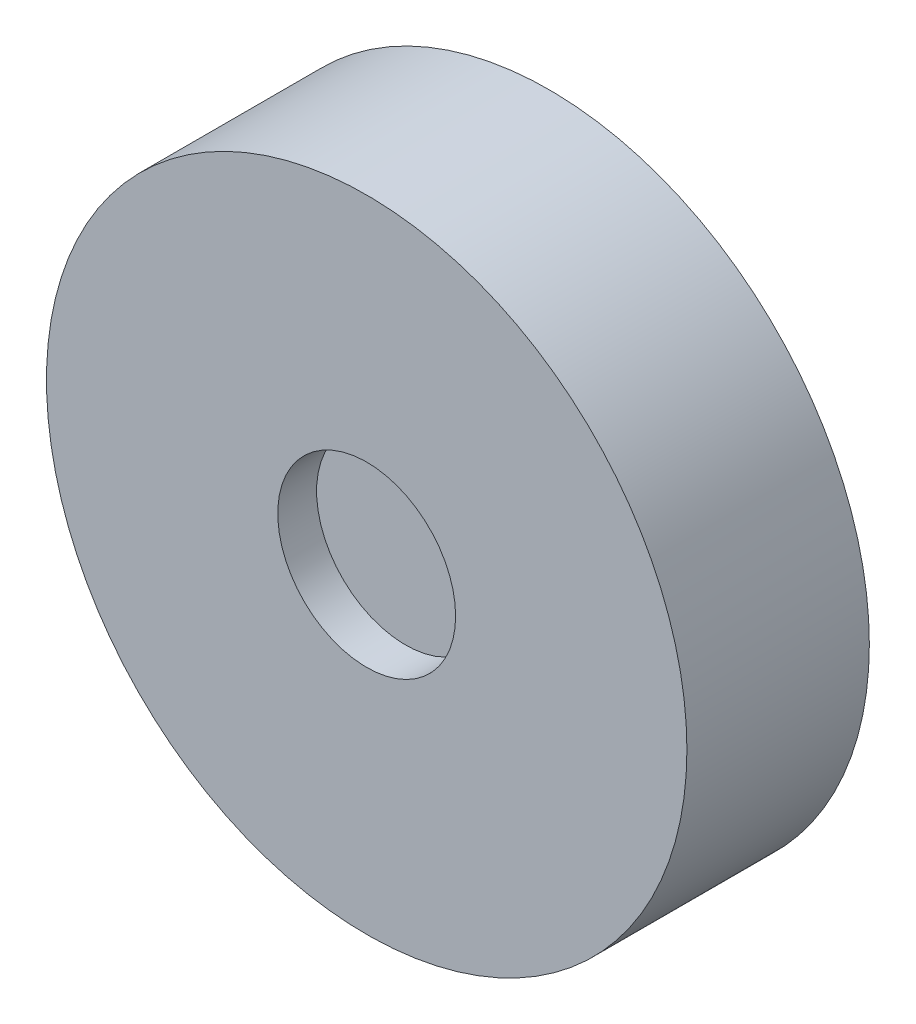
from build123d import *

# Parameters (mm, degrees)
SKETCH1_R                     = 165
BOSS_EXTRUDE1_DEPTH           = 94
CUT_EXTRUDE7_DEPTH            = 44
CUT_EXTRUDE7_DRAFT            = 6
CUT_EXTRUDE7_PROFILE_2_DEPTH  = 44
CUT_EXTRUDE7_PROFILE_2_DRAFT  = 6
CUT_EXTRUDE7_PROFILE_3_DEPTH  = 44
CUT_EXTRUDE7_PROFILE_3_DRAFT  = 6
CUT_EXTRUDE7_PROFILE_4_DEPTH  = 44
CUT_EXTRUDE7_PROFILE_4_DRAFT  = 6
CUT_EXTRUDE7_PROFILE_5_DEPTH  = 44
CUT_EXTRUDE7_PROFILE_5_DRAFT  = 6
CUT_EXTRUDE7_PROFILE_6_DEPTH  = 44
CUT_EXTRUDE7_PROFILE_6_DRAFT  = 6
CUT_EXTRUDE7_PROFILE_7_DEPTH  = 44
CUT_EXTRUDE7_PROFILE_7_DRAFT  = 6
CUT_EXTRUDE7_PROFILE_8_DEPTH  = 44
CUT_EXTRUDE7_PROFILE_8_DRAFT  = 6
CUT_EXTRUDE7_PROFILE_9_DEPTH  = 44
CUT_EXTRUDE7_PROFILE_9_DRAFT  = 6
CUT_EXTRUDE7_PROFILE_10_DEPTH = 44
CUT_EXTRUDE7_PROFILE_10_DRAFT = 6
CUT_EXTRUDE7_PROFILE_11_DEPTH = 44
CUT_EXTRUDE7_PROFILE_11_DRAFT = 6
CUT_EXTRUDE7_PROFILE_12_DEPTH = 44
CUT_EXTRUDE7_PROFILE_12_DRAFT = 6
SKETCH3_R                     = 124.372017203
SKETCH3_R_2                   = 113.555284958
CUT_EXTRUDE8_DEPTH            = 3
SKETCH4_OUTSIDE_W             = 427.212
SKETCH4_OUTSIDE_H             = 427.212
SKETCH4_OUTSIDE_R             = 165
SKETCH4_OUTSIDE_R_2           = 45.82477688
CUT_EXTRUDE9_DEPTH            = 20


with BuildPart() as part:
    # Sketch1 → Boss-Extrude1 (new body)
    with BuildSketch(Plane.XY):
        with Locations((-394.292920308, -79.904057714)):
            Circle(SKETCH1_R)
    extrude(amount=BOSS_EXTRUDE1_DEPTH)


with BuildPart() as cut_extrude7_tool:
    # Sketch2 → Cut-Extrude7 (with draft: the straight prism first)
    with BuildSketch(Plane.XY):
        with BuildLine():
            ThreePointArc((-467.639479029, -22.199836842), (-476.994852518, -36.462446087), (-483.682256538, -52.153961727))
            ThreePointArc((-483.682256538, -52.153961727), (-458.559252612, -62.946672421), (-431.984974644, -69.385281038))
            ThreePointArc((-431.984974644, -69.385281038), (-425.372423175, -66.397451896), (-425.442963934, -59.14155885))
            ThreePointArc((-425.442963934, -59.14155885), (-445.877571681, -39.912646859), (-467.639479029, -22.199836842))
        make_face()
    extrude(amount=CUT_EXTRUDE7_DEPTH)
    # Cut-Extrude7: the draft: its side faces are tilted about the plane it starts from
    cut_extrude7_sides = [cut_extrude7_tool.faces().sort_by_distance(p)[0] for p in [
        (-476.994852518, -36.462446087, 22),
        (-458.559252612, -62.946672421, 22),
        (-425.372423175, -66.397451896, 22),
        (-445.877571681, -39.912646859, 22),
    ]]
    draft(cut_extrude7_sides, Plane.XY, CUT_EXTRUDE7_DRAFT)


with BuildPart() as part_1:
    add(part.part)

    # Cut-Extrude7: cut by cut_extrude7_tool
    add(cut_extrude7_tool.part, mode=Mode.SUBTRACT)


with BuildPart() as cut_extrude7_profile_2_tool:
    # Sketch2 → Cut-Extrude7 profile 2 (with draft: the straight prism first)
    with BuildSketch(Plane.XY):
        with BuildLine():
            ThreePointArc((-487.36401918, -67.885154466), (-488.334705662, -84.914623141), (-486.280409608, -101.847576319))
            ThreePointArc((-486.280409608, -101.847576319), (-459.126894641, -98.632835993), (-432.893590526, -90.921695636))
            ThreePointArc((-432.893590526, -90.921695636), (-428.660867541, -85.027883963), (-432.349904153, -78.779366636))
            ThreePointArc((-432.349904153, -78.779366636), (-459.661249574, -72.343944239), (-487.36401918, -67.885154466))
        make_face()
    extrude(amount=CUT_EXTRUDE7_PROFILE_2_DEPTH)
    # Cut-Extrude7 profile 2: the draft: its side faces are tilted about the plane it starts from
    cut_extrude7_profile_2_sides = [cut_extrude7_profile_2_tool.faces().sort_by_distance(p)[0] for p in [
        (-488.334705662, -84.914623141, 22),
        (-459.126894641, -98.632835993, 22),
        (-428.660867541, -85.027883963, 22),
        (-459.661249574, -72.343944239, 22),
    ]]
    draft(cut_extrude7_profile_2_sides, Plane.XY, CUT_EXTRUDE7_PROFILE_2_DRAFT)


with BuildPart() as part_2:
    add(part_1.part)

    # Cut-Extrude7 profile 2: cut by cut_extrude7_profile_2_tool
    add(cut_extrude7_profile_2_tool.part, mode=Mode.SUBTRACT)


with BuildPart() as cut_extrude7_profile_3_tool:
    # Sketch2 → Cut-Extrude7 profile 3 (with draft: the straight prism first)
    with BuildSketch(Plane.XY):
        with BuildLine():
            ThreePointArc((-427.714867368, 7.502538725), (-442.948163094, -0.171556461), (-456.58538268, -10.41710562))
            ThreePointArc((-456.58538268, -10.41710562), (-440.224578408, -32.325369219), (-420.429882909, -51.18850683))
            ThreePointArc((-420.429882909, -51.18850683), (-413.209330783, -51.907246626), (-409.642474348, -45.588188541))
            ThreePointArc((-409.642474348, -45.588188541), (-417.724907778, -18.718158396), (-427.714867368, 7.502538725))
        make_face()
    extrude(amount=CUT_EXTRUDE7_PROFILE_3_DEPTH)
    # Cut-Extrude7 profile 3: the draft: its side faces are tilted about the plane it starts from
    cut_extrude7_profile_3_sides = [cut_extrude7_profile_3_tool.faces().sort_by_distance(p)[0] for p in [
        (-442.948163094, -0.171556461, 22),
        (-440.224578408, -32.325369219, 22),
        (-413.209330783, -51.907246626, 22),
        (-417.724907778, -18.718158396, 22),
    ]]
    draft(cut_extrude7_profile_3_sides, Plane.XY, CUT_EXTRUDE7_PROFILE_3_DRAFT)


with BuildPart() as part_3:
    add(part_2.part)

    # Cut-Extrude7 profile 3: cut by cut_extrude7_profile_3_tool
    add(cut_extrude7_profile_3_tool.part, mode=Mode.SUBTRACT)


with BuildPart() as cut_extrude7_profile_4_tool:
    # Sketch2 → Cut-Extrude7 profile 4 (with draft: the straight prism first)
    with BuildSketch(Plane.XY):
        with BuildLine():
            ThreePointArc((-378.28795165, 13.263244687), (-395.317420325, 14.233931169), (-412.250373503, 12.179635115))
            ThreePointArc((-412.250373503, 12.179635115), (-409.035633176, -14.973879852), (-401.32449282, -41.207183967))
            ThreePointArc((-401.32449282, -41.207183967), (-395.430681147, -45.439906952), (-389.18216382, -41.75087034))
            ThreePointArc((-389.18216382, -41.75087034), (-382.746741422, -14.439524919), (-378.28795165, 13.263244687))
        make_face()
    extrude(amount=CUT_EXTRUDE7_PROFILE_4_DEPTH)
    # Cut-Extrude7 profile 4: the draft: its side faces are tilted about the plane it starts from
    cut_extrude7_profile_4_sides = [cut_extrude7_profile_4_tool.faces().sort_by_distance(p)[0] for p in [
        (-395.317420325, 14.233931169, 22),
        (-409.035633176, -14.973879852, 22),
        (-395.430681147, -45.439906952, 22),
        (-382.746741422, -14.439524919, 22),
    ]]
    draft(cut_extrude7_profile_4_sides, Plane.XY, CUT_EXTRUDE7_PROFILE_4_DRAFT)


with BuildPart() as part_4:
    add(part_3.part)

    # Cut-Extrude7 profile 4: cut by cut_extrude7_profile_4_tool
    add(cut_extrude7_profile_4_tool.part, mode=Mode.SUBTRACT)


with BuildPart() as cut_extrude7_profile_5_tool:
    # Sketch2 → Cut-Extrude7 profile 5 (with draft: the straight prism first)
    with BuildSketch(Plane.XY):
        with BuildLine():
            ThreePointArc((-332.602634026, -6.461295464), (-346.865243271, 2.894078025), (-362.556758911, 9.581482045))
            ThreePointArc((-362.556758911, 9.581482045), (-373.349469605, -15.541521881), (-379.788078221, -42.115799849))
            ThreePointArc((-379.788078221, -42.115799849), (-376.80024908, -48.728351317), (-369.544356033, -48.657810559))
            ThreePointArc((-369.544356033, -48.657810559), (-350.315444042, -28.223202812), (-332.602634026, -6.461295464))
        make_face()
    extrude(amount=CUT_EXTRUDE7_PROFILE_5_DEPTH)
    # Cut-Extrude7 profile 5: the draft: its side faces are tilted about the plane it starts from
    cut_extrude7_profile_5_sides = [cut_extrude7_profile_5_tool.faces().sort_by_distance(p)[0] for p in [
        (-350.315444042, -28.223202812, 22),
        (-346.865243271, 2.894078025, 22),
        (-373.349469605, -15.541521881, 22),
        (-376.80024908, -48.728351317, 22),
    ]]
    draft(cut_extrude7_profile_5_sides, Plane.XY, CUT_EXTRUDE7_PROFILE_5_DRAFT)


with BuildPart() as part_5:
    add(part_4.part)

    # Cut-Extrude7 profile 5: cut by cut_extrude7_profile_5_tool
    add(cut_extrude7_profile_5_tool.part, mode=Mode.SUBTRACT)


with BuildPart() as cut_extrude7_profile_6_tool:
    # Sketch2 → Cut-Extrude7 profile 6 (with draft: the straight prism first)
    with BuildSketch(Plane.XY):
        with BuildLine():
            ThreePointArc((-302.900258459, -46.385907125), (-310.574353645, -31.152611399), (-320.819902803, -17.515391812))
            ThreePointArc((-320.819902803, -17.515391812), (-342.728166403, -33.876196085), (-361.591304014, -53.670891584))
            ThreePointArc((-361.591304014, -53.670891584), (-362.310043809, -60.89144371), (-355.990985725, -64.458300145))
            ThreePointArc((-355.990985725, -64.458300145), (-329.12095558, -56.375866715), (-302.900258459, -46.385907125))
        make_face()
    extrude(amount=CUT_EXTRUDE7_PROFILE_6_DEPTH)
    # Cut-Extrude7 profile 6: the draft: its side faces are tilted about the plane it starts from
    cut_extrude7_profile_6_sides = [cut_extrude7_profile_6_tool.faces().sort_by_distance(p)[0] for p in [
        (-310.574353645, -31.152611399, 22),
        (-342.728166403, -33.876196085, 22),
        (-362.310043809, -60.89144371, 22),
        (-329.12095558, -56.375866715, 22),
    ]]
    draft(cut_extrude7_profile_6_sides, Plane.XY, CUT_EXTRUDE7_PROFILE_6_DRAFT)


with BuildPart() as part_6:
    add(part_5.part)

    # Cut-Extrude7 profile 6: cut by cut_extrude7_profile_6_tool
    add(cut_extrude7_profile_6_tool.part, mode=Mode.SUBTRACT)


with BuildPart() as cut_extrude7_profile_7_tool:
    # Sketch2 → Cut-Extrude7 profile 7 (with draft: the straight prism first)
    with BuildSketch(Plane.XY):
        with BuildLine():
            ThreePointArc((-297.139552496, -95.812822843), (-296.168866015, -78.783354168), (-298.223162069, -61.85040099))
            ThreePointArc((-298.223162069, -61.85040099), (-325.376677035, -65.065141317), (-351.60998115, -72.776281673))
            ThreePointArc((-351.60998115, -72.776281673), (-355.842704136, -78.670093346), (-352.153667523, -84.918610673))
            ThreePointArc((-352.153667523, -84.918610673), (-324.842322103, -91.354033071), (-297.139552496, -95.812822843))
        make_face()
    extrude(amount=CUT_EXTRUDE7_PROFILE_7_DEPTH)
    # Cut-Extrude7 profile 7: the draft: its side faces are tilted about the plane it starts from
    cut_extrude7_profile_7_sides = [cut_extrude7_profile_7_tool.faces().sort_by_distance(p)[0] for p in [
        (-355.842704136, -78.670093346, 22),
        (-324.842322103, -91.354033071, 22),
        (-296.168866015, -78.783354168, 22),
        (-325.376677035, -65.065141317, 22),
    ]]
    draft(cut_extrude7_profile_7_sides, Plane.XY, CUT_EXTRUDE7_PROFILE_7_DRAFT)


with BuildPart() as part_7:
    add(part_6.part)

    # Cut-Extrude7 profile 7: cut by cut_extrude7_profile_7_tool
    add(cut_extrude7_profile_7_tool.part, mode=Mode.SUBTRACT)


with BuildPart() as cut_extrude7_profile_8_tool:
    # Sketch2 → Cut-Extrude7 profile 8 (with draft: the straight prism first)
    with BuildSketch(Plane.XY):
        with BuildLine():
            ThreePointArc((-316.864092648, -141.498140467), (-307.508719158, -127.235531222), (-300.821315139, -111.544015582))
            ThreePointArc((-300.821315139, -111.544015582), (-325.944319065, -100.751304888), (-352.518597032, -94.312696272))
            ThreePointArc((-352.518597032, -94.312696272), (-359.131148501, -97.300525413), (-359.060607743, -104.55641846))
            ThreePointArc((-359.060607743, -104.55641846), (-338.625999996, -123.785330451), (-316.864092648, -141.498140467))
        make_face()
    extrude(amount=CUT_EXTRUDE7_PROFILE_8_DEPTH)
    # Cut-Extrude7 profile 8: the draft: its side faces are tilted about the plane it starts from
    cut_extrude7_profile_8_sides = [cut_extrude7_profile_8_tool.faces().sort_by_distance(p)[0] for p in [
        (-338.625999996, -123.785330451, 22),
        (-307.508719158, -127.235531222, 22),
        (-325.944319065, -100.751304888, 22),
        (-359.131148501, -97.300525413, 22),
    ]]
    draft(cut_extrude7_profile_8_sides, Plane.XY, CUT_EXTRUDE7_PROFILE_8_DRAFT)


with BuildPart() as part_8:
    add(part_7.part)

    # Cut-Extrude7 profile 8: cut by cut_extrude7_profile_8_tool
    add(cut_extrude7_profile_8_tool.part, mode=Mode.SUBTRACT)


with BuildPart() as cut_extrude7_profile_9_tool:
    # Sketch2 → Cut-Extrude7 profile 9 (with draft: the straight prism first)
    with BuildSketch(Plane.XY):
        with BuildLine():
            ThreePointArc((-356.788704309, -171.200516034), (-341.555408582, -163.526420848), (-327.918188996, -153.28087169))
            ThreePointArc((-327.918188996, -153.28087169), (-344.278993269, -131.37260809), (-364.073688767, -112.509470479))
            ThreePointArc((-364.073688767, -112.509470479), (-371.294240894, -111.790730683), (-374.861097329, -118.109788768))
            ThreePointArc((-374.861097329, -118.109788768), (-366.778663899, -144.979818913), (-356.788704309, -171.200516034))
        make_face()
    extrude(amount=CUT_EXTRUDE7_PROFILE_9_DEPTH)
    # Cut-Extrude7 profile 9: the draft: its side faces are tilted about the plane it starts from
    cut_extrude7_profile_9_sides = [cut_extrude7_profile_9_tool.faces().sort_by_distance(p)[0] for p in [
        (-366.778663899, -144.979818913, 22),
        (-341.555408582, -163.526420848, 22),
        (-344.278993269, -131.37260809, 22),
        (-371.294240894, -111.790730683, 22),
    ]]
    draft(cut_extrude7_profile_9_sides, Plane.XY, CUT_EXTRUDE7_PROFILE_9_DRAFT)


with BuildPart() as part_9:
    add(part_8.part)

    # Cut-Extrude7 profile 9: cut by cut_extrude7_profile_9_tool
    add(cut_extrude7_profile_9_tool.part, mode=Mode.SUBTRACT)


with BuildPart() as cut_extrude7_profile_10_tool:
    # Sketch2 → Cut-Extrude7 profile 10 (with draft: the straight prism first)
    with BuildSketch(Plane.XY):
        with BuildLine():
            ThreePointArc((-406.215620027, -176.961221997), (-389.186151352, -177.931908478), (-372.253198174, -175.877612424))
            ThreePointArc((-372.253198174, -175.877612424), (-375.4679385, -148.724097458), (-383.179078857, -122.490793343))
            ThreePointArc((-383.179078857, -122.490793343), (-389.07289053, -118.258070357), (-395.321407856, -121.947106969))
            ThreePointArc((-395.321407856, -121.947106969), (-401.756830254, -149.25845239), (-406.215620027, -176.961221997))
        make_face()
    extrude(amount=CUT_EXTRUDE7_PROFILE_10_DEPTH)
    # Cut-Extrude7 profile 10: the draft: its side faces are tilted about the plane it starts from
    cut_extrude7_profile_10_sides = [cut_extrude7_profile_10_tool.faces().sort_by_distance(p)[0] for p in [
        (-401.756830254, -149.25845239, 22),
        (-389.186151352, -177.931908478, 22),
        (-375.4679385, -148.724097458, 22),
        (-389.07289053, -118.258070357, 22),
    ]]
    draft(cut_extrude7_profile_10_sides, Plane.XY, CUT_EXTRUDE7_PROFILE_10_DRAFT)


with BuildPart() as part_10:
    add(part_9.part)

    # Cut-Extrude7 profile 10: cut by cut_extrude7_profile_10_tool
    add(cut_extrude7_profile_10_tool.part, mode=Mode.SUBTRACT)


with BuildPart() as cut_extrude7_profile_11_tool:
    # Sketch2 → Cut-Extrude7 profile 11 (with draft: the straight prism first)
    with BuildSketch(Plane.XY):
        with BuildLine():
            ThreePointArc((-451.900937651, -157.236681845), (-437.638328406, -166.592055335), (-421.946812766, -173.279459354))
            ThreePointArc((-421.946812766, -173.279459354), (-411.154102072, -148.156455428), (-404.715493455, -121.582177461))
            ThreePointArc((-404.715493455, -121.582177461), (-407.703322596, -114.969625992), (-414.959215643, -115.04016675))
            ThreePointArc((-414.959215643, -115.04016675), (-434.188127634, -135.474774497), (-451.900937651, -157.236681845))
        make_face()
    extrude(amount=CUT_EXTRUDE7_PROFILE_11_DEPTH)
    # Cut-Extrude7 profile 11: the draft: its side faces are tilted about the plane it starts from
    cut_extrude7_profile_11_sides = [cut_extrude7_profile_11_tool.faces().sort_by_distance(p)[0] for p in [
        (-437.638328406, -166.592055335, 22),
        (-411.154102072, -148.156455428, 22),
        (-407.703322596, -114.969625992, 22),
        (-434.188127634, -135.474774497, 22),
    ]]
    draft(cut_extrude7_profile_11_sides, Plane.XY, CUT_EXTRUDE7_PROFILE_11_DRAFT)


with BuildPart() as part_11:
    add(part_10.part)

    # Cut-Extrude7 profile 11: cut by cut_extrude7_profile_11_tool
    add(cut_extrude7_profile_11_tool.part, mode=Mode.SUBTRACT)


with BuildPart() as cut_extrude7_profile_12_tool:
    # Sketch2 → Cut-Extrude7 profile 12 (with draft: the straight prism first)
    with BuildSketch(Plane.XY):
        with BuildLine():
            ThreePointArc((-481.603313217, -117.312070184), (-473.929218032, -132.54536591), (-463.683668873, -146.182585497))
            ThreePointArc((-463.683668873, -146.182585497), (-441.775405273, -129.821781224), (-422.912267663, -110.027085726))
            ThreePointArc((-422.912267663, -110.027085726), (-422.193527867, -102.806533599), (-428.512585952, -99.239677164))
            ThreePointArc((-428.512585952, -99.239677164), (-455.382616096, -107.322110594), (-481.603313217, -117.312070184))
        make_face()
    extrude(amount=CUT_EXTRUDE7_PROFILE_12_DEPTH)
    # Cut-Extrude7 profile 12: the draft: its side faces are tilted about the plane it starts from
    cut_extrude7_profile_12_sides = [cut_extrude7_profile_12_tool.faces().sort_by_distance(p)[0] for p in [
        (-473.929218032, -132.54536591, 22),
        (-441.775405273, -129.821781224, 22),
        (-422.193527867, -102.806533599, 22),
        (-455.382616096, -107.322110594, 22),
    ]]
    draft(cut_extrude7_profile_12_sides, Plane.XY, CUT_EXTRUDE7_PROFILE_12_DRAFT)


with BuildPart() as part_12:
    add(part_11.part)

    # Cut-Extrude7 profile 12: cut by cut_extrude7_profile_12_tool
    add(cut_extrude7_profile_12_tool.part, mode=Mode.SUBTRACT)

    # Sketch3 → Cut-Extrude8 (cut)
    with BuildSketch(Plane(origin=(0, 0, 0), x_dir=(-1, 0, 0), z_dir=(0, 0, -1))):
        with Locations((392.251785838, -81.848988655)):
            Circle(SKETCH3_R)
        with Locations((392.251785838, -81.848988655)):
            Circle(SKETCH3_R_2, mode=Mode.SUBTRACT)
    extrude(amount=-CUT_EXTRUDE8_DEPTH, mode=Mode.SUBTRACT)

    # Sketch4 outside → Cut-Extrude9 (cut)
    # profile 1 of 2: a face of its own
    with BuildSketch(Plane.XY.offset(94)):
        with Locations((-394.293, -79.904)):
            Rectangle(SKETCH4_OUTSIDE_W, SKETCH4_OUTSIDE_H)
        with Locations((-394.292920308, -79.904057714)):
            Circle(SKETCH4_OUTSIDE_R, mode=Mode.SUBTRACT)
    # profile 2 of 2: a face of its own
    with BuildSketch(Plane.XY.offset(94)):
        with Locations((-394.292920308, -79.904057714)):
            Circle(SKETCH4_OUTSIDE_R_2)
    extrude(amount=-CUT_EXTRUDE9_DEPTH, mode=Mode.SUBTRACT)


solid = part_12.part
